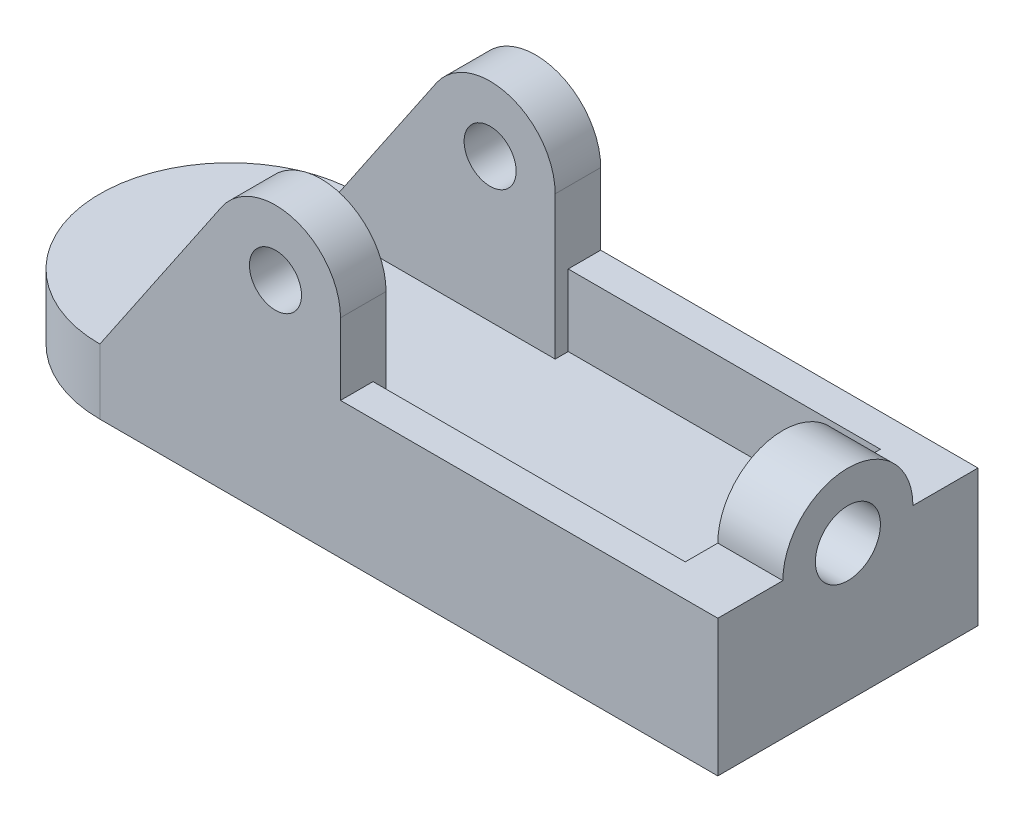
from build123d import *

# Parameters (mm, degrees)
BOSS_EXTRUDE1_DEPTH = 10
SKETCH2_R           = 4
BOSS_EXTRUDE2_DEPTH = 7
BOSS_EXTRUDE3_DEPTH = 11
SKETCH5_R           = 5
BOSS_EXTRUDE4_DEPTH = 10


with BuildPart() as part:
    # Sketch1 → Boss-Extrude1 (new body)
    with BuildSketch(Plane(origin=(0, 0, 0), x_dir=(1, 0, 0), z_dir=(0, 1, 0))):
        with BuildLine():
            Line((0, -20), (95, -20))
            Line((95, -20), (95, 20))
            Line((95, 20), (0, 20))
            ThreePointArc((0, 20), (-20, 0), (0, -20))
        make_face()
        with BuildLine():
            Line((0, -5), (16.830680512, -5))
            ThreePointArc((16.830680512, -5), (21.830680512, 0), (16.830680512, 5))
            Line((16.830680512, 5), (0, 5))
            ThreePointArc((0, 5), (-5, 0), (0, -5))
        make_face(mode=Mode.SUBTRACT)
    extrude(amount=BOSS_EXTRUDE1_DEPTH)

    # Sketch2 → Boss-Extrude2 (add)
    with BuildSketch(Plane.XY.offset(20)):
        with BuildLine():
            Line((0, 10), (37, 10))
            Line((37, 10), (37, 32))
            ThreePointArc((37, 32), (29.935438849, 41.559455987), (18.723360248, 37.612239696))
            Line((18.723360248, 37.612239696), (0, 10))
        make_face()
        with Locations((27, 32)):
            Circle(SKETCH2_R, mode=Mode.SUBTRACT)
    boss_extrude2 = extrude(amount=-BOSS_EXTRUDE2_DEPTH)

    # Mirror1: Boss-Extrude2 across plane
    add(boss_extrude2.mirror(Plane.XY))

    # Sketch4 → Boss-Extrude3 (add)
    with BuildSketch(Plane(origin=(0, 10, 0), x_dir=(1, 0, 0), z_dir=(0, 1, 0))):
        Polygon((37, -20), (95, -20), (95, -10), (85, -10), (85, -15), (37, -15), align=None)
    boss_extrude3 = extrude(amount=BOSS_EXTRUDE3_DEPTH)

    # Mirror2: Boss-Extrude3 across plane
    add(boss_extrude3.mirror(Plane.XY))

    # Sketch5 → Boss-Extrude4 (add)
    with BuildSketch(Plane(origin=(95, 0, 0), x_dir=(0, 0, -1), z_dir=(1, 0, 0))):
        with BuildLine():
            Line((-10, 10), (10, 10))
            Line((10, 10), (10, 21))
            ThreePointArc((10, 21), (0, 31), (-10, 21))
            Line((-10, 21), (-10, 10))
        make_face()
        with Locations((0, 21)):
            Circle(SKETCH5_R, mode=Mode.SUBTRACT)
    extrude(amount=-BOSS_EXTRUDE4_DEPTH)


solid = part.part
